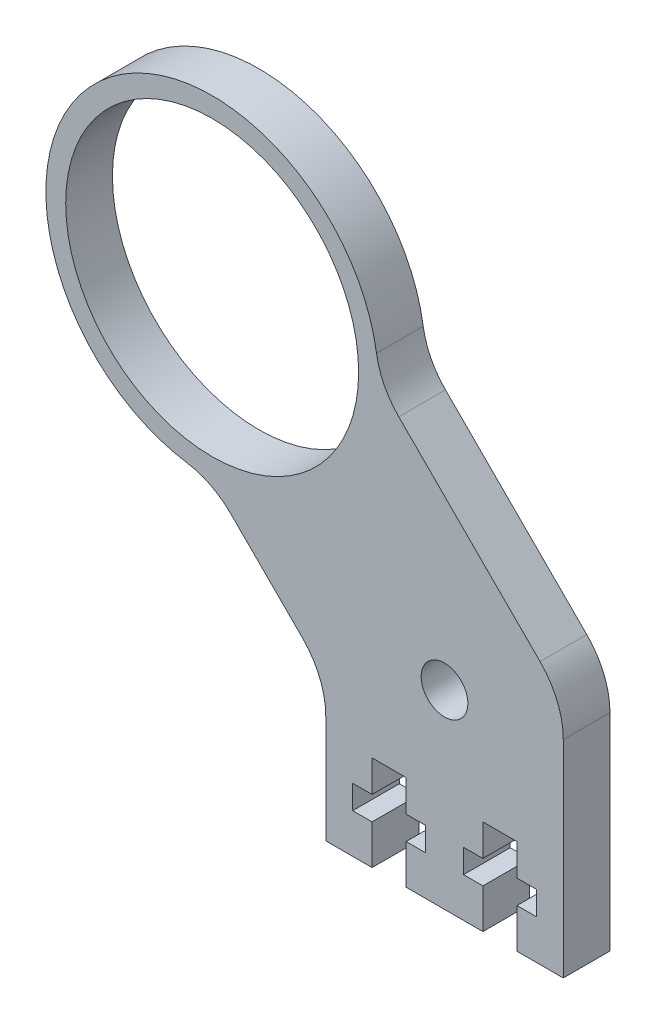
from build123d import *

# Parameters (mm, degrees)
SKETCH1_R           = 2.95
BOSS_EXTRUDE1_DEPTH = 5.9
SKETCH2_R           = 18.5
CUT_EXTRUDE1_DEPTH  = 72.442524026
CUT_EXTRUDE2_DEPTH  = 72.442524026
FILLET1_R           = 10


with BuildPart() as part:
    # Sketch1 → Boss-Extrude1 (new body)
    with BuildSketch(Plane.XY):
        with BuildLine():
            Line((-15, -6.213203436), (-15, -24))
            Line((-15, -24), (15, -24))
            Line((15, -24), (15, 6.213203436))
            Line((15, 6.213203436), (-8.346024856, 29.559228292))
            ThreePointArc((-8.346024856, 29.559228292), (-44.194173824, 44.194173824), (-29.559228292, 8.346024856))
            Line((-29.559228292, 8.346024856), (-15, -6.213203436))
        make_face()
        Circle(SKETCH1_R, mode=Mode.SUBTRACT)
    extrude(amount=BOSS_EXTRUDE1_DEPTH)

    # Sketch2 → Cut-Extrude1 (cut, through all)
    with BuildSketch(Plane.XY.offset(5.9)):
        with Locations((-29.344931419, 29.344931419)):
            Circle(SKETCH2_R)
    extrude(amount=-CUT_EXTRUDE1_DEPTH, mode=Mode.SUBTRACT)

    # Sketch3 → Cut-Extrude2 (cut, through all)
    with BuildSketch(Plane.XY.offset(5.9)):
        Polygon((-9.15, -24), (-4.85, -24), (-4.85, -19), (-2.4, -19), (-2.4, -16), (-4.85, -16), (-4.85, -12), (-9.15, -12), (-9.15, -16), (-11.6, -16), (-11.6, -19), (-9.15, -19), align=None)
        Polygon((4.85, -16), (4.85, -12), (9.15, -12), (9.15, -16), (11.6, -16), (11.6, -19), (9.15, -19), (9.15, -24), (4.85, -24), (4.85, -19), (2.4, -19), (2.4, -16), align=None)
    extrude(amount=-CUT_EXTRUDE2_DEPTH, mode=Mode.SUBTRACT)

    # Fillet1
    fillet1_edges = [part.edges().sort_by_distance(p)[0] for p in [
        (-8.346024856, 29.559228292, 2.95),
        (15, 6.213203436, 2.95),
        (-15, -6.213203436, 2.95),
        (-29.559228292, 8.346024856, 2.95),
    ]]
    fillet(fillet1_edges, radius=FILLET1_R)


solid = part.part
